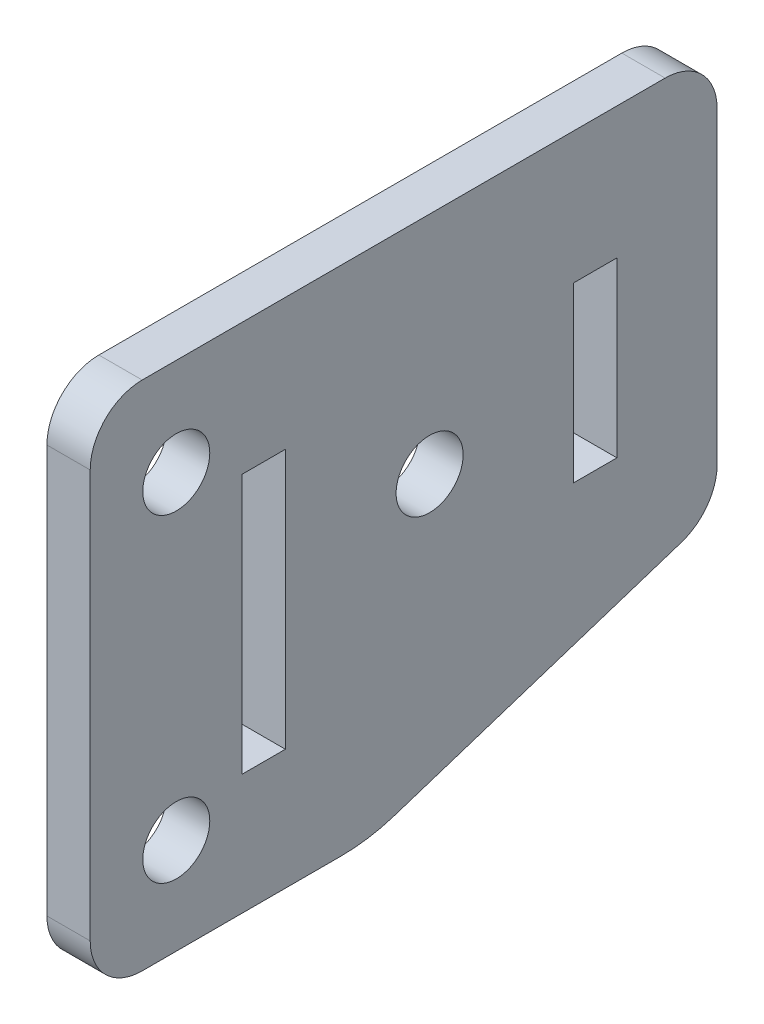
from build123d import *

# Parameters (mm, degrees)
BOSS_EXTRUDE1_DEPTH              = 3.175
F_10_0_1935_DIAMETER_HOLE1_D     = 4.9149
F_10_0_1935_DIAMETER_HOLE1_DEPTH = 11.176
F_10_0_1935_DIAMETER_HOLE1_TIP   = 1.476584928
SKETCH6_W                        = 3.175
SKETCH6_H                        = 19.05
SKETCH6_H_2                      = 12.7
CUT_EXTRUDE1_DEPTH               = 63.852683642
FILLET1_R                        = 3.81


with BuildPart() as part:
    # Sketch1 → Boss-Extrude1 (new body)
    with BuildSketch(Plane(origin=(0, 0, 0), x_dir=(0, 0, -1), z_dir=(1, 0, 0))):
        with BuildLine():
            Line((-11.43, 25.4), (-57.404, 25.4))
            Line((-57.404, 25.4), (-57.404, -12.13104))
            Line((-57.404, -12.13104), (-39.203469383, -12.13104))
            Line((-39.203469383, -12.13104), (-38.998073701, -12.13104))
            ThreePointArc((-38.998073701, -12.13104), (-37.012948259, -11.974934012), (-35.076624386, -11.510453697))
            Line((-35.076624386, -11.510453697), (-11.43, -3.833836163))
            Line((-11.43, -3.833836163), (-11.43, 25.4))
        make_face()
    extrude(amount=-BOSS_EXTRUDE1_DEPTH)

    # #10 (0.1935) Diameter Hole1
    with Locations(Plane(origin=(0, 0, 0), x_dir=(0, 0, -1), z_dir=(1, 0, 0))):
        with Locations((-51.0921, -5.08), (-51.0921, 18.288), (-32.512, 8.89)):
            Hole(F_10_0_1935_DIAMETER_HOLE1_D / 2, depth=F_10_0_1935_DIAMETER_HOLE1_DEPTH)
            with Locations((0, 0, -(F_10_0_1935_DIAMETER_HOLE1_DEPTH + F_10_0_1935_DIAMETER_HOLE1_TIP / 2))):  # 118° drill point
                Cone(0, F_10_0_1935_DIAMETER_HOLE1_D / 2, F_10_0_1935_DIAMETER_HOLE1_TIP, mode=Mode.SUBTRACT)

    # Sketch6 → Cut-Extrude1 (cut, through all)
    with BuildSketch(Plane.ZY.offset(3.175)):
        with Locations((44.6786, 6.223)):
            Rectangle(SKETCH6_W, SKETCH6_H)
        with Locations((20.364644497, 9.398)):
            Rectangle(SKETCH6_W, SKETCH6_H_2)
    extrude(amount=-CUT_EXTRUDE1_DEPTH, mode=Mode.SUBTRACT)

    # Fillet1
    fillet1_edges = [part.edges().sort_by_distance(p)[0] for p in [
        (-1.5875, -12.13104, 57.404),
        (-1.5875, 25.4, 57.404),
        (-1.5875, 25.4, 11.43),
        (-1.5875, -3.833836163, 11.43),
    ]]
    fillet(fillet1_edges, radius=FILLET1_R)


solid = part.part
